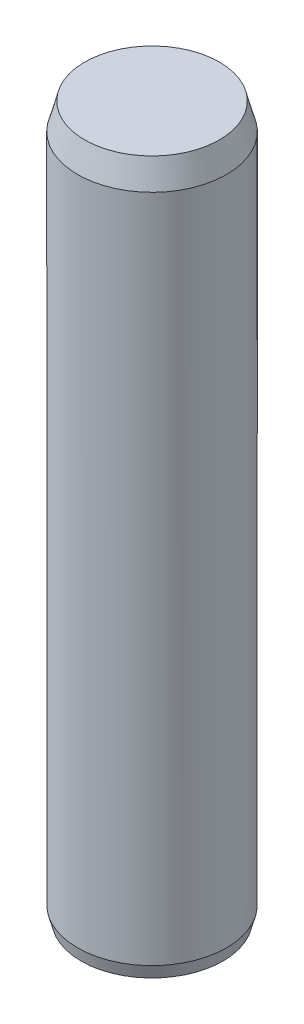
from build123d import *

# Parameters (mm, degrees)
SKETCH1_R           = 21
BOSS_EXTRUDE1_DEPTH = 200
CHAMFER1_SIZE       = 2
CHAMFER1_SIZE2      = 7.464101615
CHAMFER2_SIZE       = 1
CHAMFER2_SIZE2      = 3.732050808


with BuildPart() as part:
    # Sketch1 → Boss-Extrude1 (new body)
    with BuildSketch(Plane(origin=(0, 0, 0), x_dir=(1, 0, 0), z_dir=(0, 1, 0))):
        with Locations(Location((0, 0, 0), (0, 0, 270))):
            Circle(SKETCH1_R)
    extrude(amount=BOSS_EXTRUDE1_DEPTH)

    # Chamfer1
    chamfer1_edges = [part.edges().sort_by_distance(p)[0] for p in [
        (0, 200, -21),
    ]]
    chamfer1_side = [part.faces().sort_by_distance(p)[0] for p in [
        (0, 200, 0),
    ]]
    chamfer(chamfer1_edges, length=CHAMFER1_SIZE, length2=CHAMFER1_SIZE2, reference=chamfer1_side[0])

    # Chamfer2
    chamfer2_edges = [part.edges().sort_by_distance(p)[0] for p in [
        (0, 0, -21),
    ]]
    chamfer2_side = [part.faces().sort_by_distance(p)[0] for p in [
        (0, 0, 0),
    ]]
    chamfer(chamfer2_edges, length=CHAMFER2_SIZE, length2=CHAMFER2_SIZE2, reference=chamfer2_side[0])


solid = part.part
